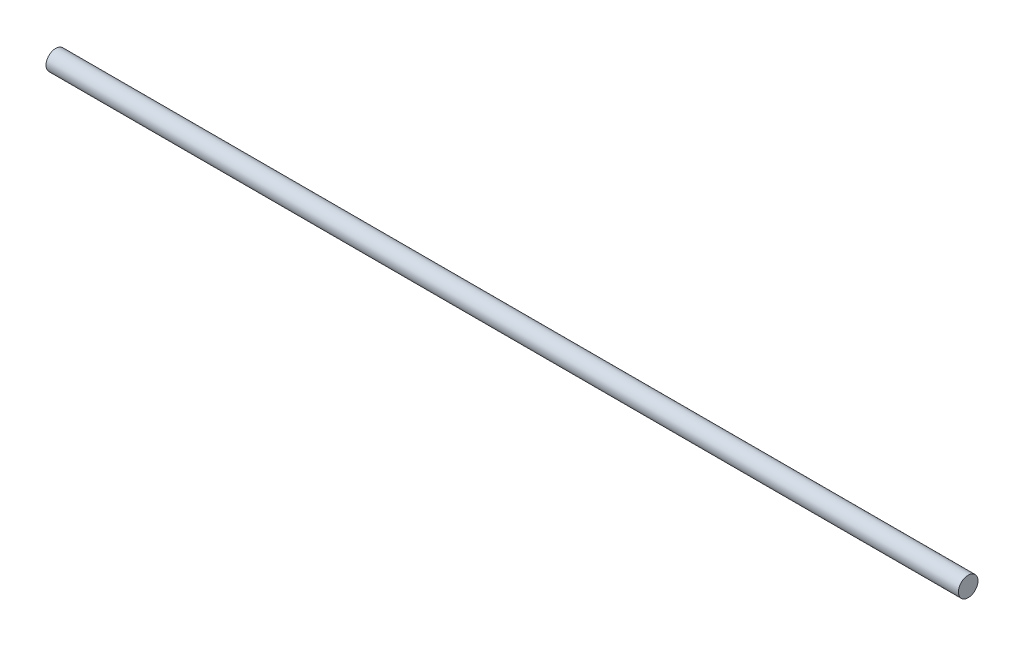
from build123d import *

# Parameters (mm, degrees)
SKETCH1_R           = 1.5
BOSS_EXTRUDE1_DEPTH = 70


with BuildPart() as part:
    # Sketch1 → Boss-Extrude1 (new, symmetric)
    with BuildSketch(Plane(origin=(0, 0, 0), x_dir=(0, 0, -1), z_dir=(1, 0, 0))):
        Circle(SKETCH1_R)
    extrude(amount=BOSS_EXTRUDE1_DEPTH, both=True)


solid = part.part
